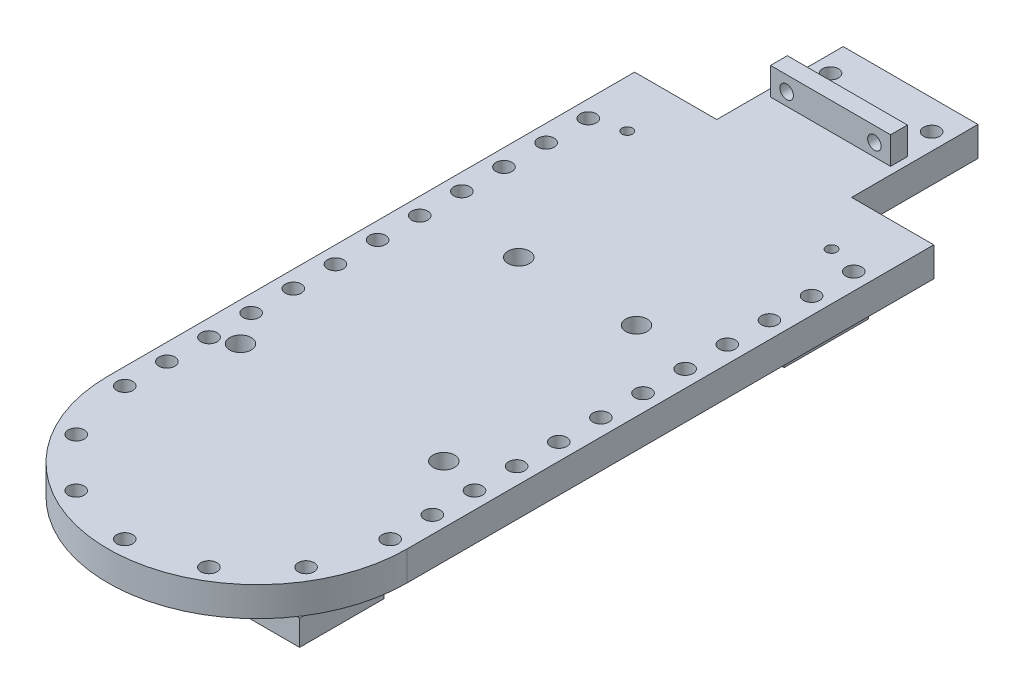
from build123d import *

# Parameters (mm, degrees)
MAIN_BODY_DEPTH     = 7
SKETCH3_W           = 32
SKETCH3_H           = 20
BOSS_EXTRUDE2_DEPTH = 7
SKETCH4_W           = 28.5
SKETCH4_H           = 4
BOSS_EXTRUDE3_DEPTH = 6.5
SKETCH7_W           = 32
SKETCH7_H           = 7
BOSS_EXTRUDE4_DEPTH = 15
SKETCH10_R          = 1.9
CUT_EXTRUDE5_DEPTH  = 7
SKETCH13_W          = 10
SKETCH13_H          = 20
BOSS_EXTRUDE5_DEPTH = 10
SKETCH14_W          = 40
SKETCH14_H          = 20
SKETCH14_R          = 1.9
BOSS_EXTRUDE6_DEPTH = 6
SKETCH17_W          = 71
SKETCH17_H          = 5
BOSS_EXTRUDE7_DEPTH = 7
SKETCH19_R          = 1.25
CUT_EXTRUDE7_DEPTH  = 7
SKETCH21_R          = 1.6
CUT_EXTRUDE9_DEPTH  = 4
SKETCH22_R          = 1.9
CUT_EXTRUDE10_DEPTH = 7
SKETCH15_R          = 2.5621
DUE_MOUNT_DEPTH     = 172.689399789


with BuildPart() as part:
    # Sketch2 → Main body (new body)
    with BuildSketch(Plane(origin=(0, 0, 0), x_dir=(1, 0, 0), z_dir=(0, 1, 0))):
        with BuildLine():
            Line((0, 0), (71, 0))
            Line((71, 0), (71, -120))
            ThreePointArc((71, -120), (35.5, -155.5), (0, -120))
            Line((0, -120), (0, 0))
        make_face()
    extrude(amount=MAIN_BODY_DEPTH)

    # Sketch3 → Boss-Extrude2 (add)
    with BuildSketch(Plane(origin=(0, 7, 0), x_dir=(1, 0, 0), z_dir=(0, 1, 0))):
        with Locations((35.5, 10)):
            Rectangle(SKETCH3_W, SKETCH3_H)
    extrude(amount=-BOSS_EXTRUDE2_DEPTH)

    # Sketch4 → Boss-Extrude3 (add)
    with BuildSketch(Plane(origin=(0, 7, 0), x_dir=(1, 0, 0), z_dir=(0, 1, 0))):
        with Locations((35.5, 18)):
            Rectangle(SKETCH4_W, SKETCH4_H)
    extrude(amount=BOSS_EXTRUDE3_DEPTH)

    # Sketch7 → Boss-Extrude4 (add)
    with BuildSketch(Plane(origin=(0, 0, -20), x_dir=(-1, 0, 0), z_dir=(0, 0, -1))):
        with Locations((-35.5, 3.5)):
            Rectangle(SKETCH7_W, SKETCH7_H)
    extrude(amount=BOSS_EXTRUDE4_DEPTH)

    # Sketch10 → Cut-Extrude5 (cut)
    with BuildSketch(Plane(origin=(0, 7, 0), x_dir=(1, 0, 0), z_dir=(0, 1, 0))):
        with Locations(Location((4, -120, 0), (0, 0, 270))):
            Circle(SKETCH10_R)
        with Locations(Location((4, -110, 0), (0, 0, 270))):
            Circle(SKETCH10_R)
        with Locations(Location((4, -100, 0), (0, 0, 270))):
            Circle(SKETCH10_R)
        with Locations(Location((4, -90, 0), (0, 0, 270))):
            Circle(SKETCH10_R)
        with Locations(Location((4, -80, 0), (0, 0, 270))):
            Circle(SKETCH10_R)
        with Locations(Location((4, -70, 0), (0, 0, 270))):
            Circle(SKETCH10_R)
        with Locations(Location((4, -60, 0), (0, 0, 270))):
            Circle(SKETCH10_R)
        with Locations(Location((4, -50, 0), (0, 0, 270))):
            Circle(SKETCH10_R)
        with Locations(Location((4, -40, 0), (0, 0, 270))):
            Circle(SKETCH10_R)
        with Locations(Location((4, -30, 0), (0, 0, 270))):
            Circle(SKETCH10_R)
        with Locations(Location((4, -20, 0), (0, 0, 270))):
            Circle(SKETCH10_R)
        with Locations(Location((4, -10, 0), (0, 0, 270))):
            Circle(SKETCH10_R)
        with Locations(Location((8.220199781, -135.75, 0), (0, 0, 270))):
            Circle(SKETCH10_R)
        with Locations(Location((19.75, -147.279800219, 0), (0, 0, 270))):
            Circle(SKETCH10_R)
        with Locations(Location((35.5, -151.5, 0), (0, 0, 270))):
            Circle(SKETCH10_R)
        with Locations(Location((51.25, -147.279800219, 0), (0, 0, 270))):
            Circle(SKETCH10_R)
        with Locations(Location((62.779800219, -135.75, 0), (0, 0, 270))):
            Circle(SKETCH10_R)
        with Locations(Location((67, -120, 0), (0, 0, 270))):
            Circle(SKETCH10_R)
        with Locations(Location((67, -10, 0), (0, 0, 270))):
            Circle(SKETCH10_R)
        with Locations(Location((67, -20, 0), (0, 0, 270))):
            Circle(SKETCH10_R)
        with Locations(Location((67, -30, 0), (0, 0, 270))):
            Circle(SKETCH10_R)
        with Locations(Location((67, -40, 0), (0, 0, 270))):
            Circle(SKETCH10_R)
        with Locations(Location((67, -50, 0), (0, 0, 270))):
            Circle(SKETCH10_R)
        with Locations(Location((67, -60, 0), (0, 0, 270))):
            Circle(SKETCH10_R)
        with Locations(Location((67, -70, 0), (0, 0, 270))):
            Circle(SKETCH10_R)
        with Locations(Location((67, -80, 0), (0, 0, 270))):
            Circle(SKETCH10_R)
        with Locations(Location((67, -90, 0), (0, 0, 270))):
            Circle(SKETCH10_R)
        with Locations(Location((67, -100, 0), (0, 0, 270))):
            Circle(SKETCH10_R)
        with Locations(Location((67, -110, 0), (0, 0, 270))):
            Circle(SKETCH10_R)
    extrude(amount=-CUT_EXTRUDE5_DEPTH, mode=Mode.SUBTRACT)

    # Sketch13 → Boss-Extrude5 (add)
    with BuildSketch(Plane.XZ):
        with Locations((35.5, 120)):
            Rectangle(SKETCH13_W, SKETCH13_H)
        with Locations((35.5, 5)):
            Rectangle(SKETCH13_W, SKETCH13_H)
    extrude(amount=BOSS_EXTRUDE5_DEPTH)

    # Sketch14 → Boss-Extrude6 (add)
    # profile 1 of 2: a face of its own
    with BuildSketch(Plane.XZ.offset(10)):
        with Locations((35.5, 120)):
            Rectangle(SKETCH14_W, SKETCH14_H)
        with Locations(Location((23, 125, 0), (0, 0, 270))):
            Circle(SKETCH14_R, mode=Mode.SUBTRACT)
        with Locations(Location((23, 115, 0), (0, 0, 90))):
            Circle(SKETCH14_R, mode=Mode.SUBTRACT)
        with Locations(Location((48, 125, 0), (0, 0, 90))):
            Circle(SKETCH14_R, mode=Mode.SUBTRACT)
        with Locations(Location((48, 115, 0), (0, 0, 270))):
            Circle(SKETCH14_R, mode=Mode.SUBTRACT)
    # profile 2 of 2: a face of its own
    with BuildSketch(Plane.XZ.offset(10)):
        with Locations((35.5, 5)):
            Rectangle(SKETCH14_W, SKETCH14_H)
        with Locations(Location((48, 0, 0), (0, 0, 270))):
            Circle(SKETCH14_R, mode=Mode.SUBTRACT)
        with Locations(Location((48, 10, 0), (0, 0, 90))):
            Circle(SKETCH14_R, mode=Mode.SUBTRACT)
        with Locations(Location((23, 0, 0), (0, 0, 90))):
            Circle(SKETCH14_R, mode=Mode.SUBTRACT)
        with Locations(Location((23, 10, 0), (0, 0, 270))):
            Circle(SKETCH14_R, mode=Mode.SUBTRACT)
    extrude(amount=BOSS_EXTRUDE6_DEPTH)

    # Sketch17 → Boss-Extrude7 (add)
    with BuildSketch(Plane(origin=(0, 7, 0), x_dir=(1, 0, 0), z_dir=(0, 1, 0))):
        with Locations((35.5, 2.5)):
            Rectangle(SKETCH17_W, SKETCH17_H)
    extrude(amount=-BOSS_EXTRUDE7_DEPTH)

    # Sketch19 → Cut-Extrude7 (cut)
    with BuildSketch(Plane(origin=(0, 7, 0), x_dir=(1, 0, 0), z_dir=(0, 1, 0))):
        with Locations(Location((11.25, -8, 0), (0, 0, 270))):
            Circle(SKETCH19_R)
        with Locations(Location((59.75, -8, 0), (0, 0, 270))):
            Circle(SKETCH19_R)
    extrude(amount=-CUT_EXTRUDE7_DEPTH, mode=Mode.SUBTRACT)

    # Sketch21 → Cut-Extrude9 (cut)
    with BuildSketch(Plane(origin=(0, 0, -20), x_dir=(-1, 0, 0), z_dir=(0, 0, -1))):
        with Locations((-45.915, 10)):
            Circle(SKETCH21_R)
        with Locations((-25.085, 10)):
            Circle(SKETCH21_R)
    extrude(amount=-CUT_EXTRUDE9_DEPTH, mode=Mode.SUBTRACT)

    # Sketch22 → Cut-Extrude10 (cut)
    with BuildSketch(Plane(origin=(0, 7, 0), x_dir=(1, 0, 0), z_dir=(0, 1, 0))):
        with Locations(Location((23.5, 28, 0), (0, 0, 270))):
            Circle(SKETCH22_R)
        with Locations(Location((47.5, 28, 0), (0, 0, 270))):
            Circle(SKETCH22_R)
    extrude(amount=-CUT_EXTRUDE10_DEPTH, mode=Mode.SUBTRACT)

    # Sketch15 → DUE mount (cut, through all)
    with BuildSketch(Plane.XZ):
        with Locations(Location((24.3162, 46.805, 0), (0, 0, 270))):
            Circle(SKETCH15_R)
        with Locations(Location((52.2562, 46.805, 0), (0, 0, 270))):
            Circle(SKETCH15_R)
        with Locations(Location((57.3362, 97.605, 0), (0, 0, 270))):
            Circle(SKETCH15_R)
        with Locations(Location((9.0762, 97.605, 0), (0, 0, 270))):
            Circle(SKETCH15_R)
    extrude(amount=-DUE_MOUNT_DEPTH, mode=Mode.SUBTRACT)


solid = part.part
